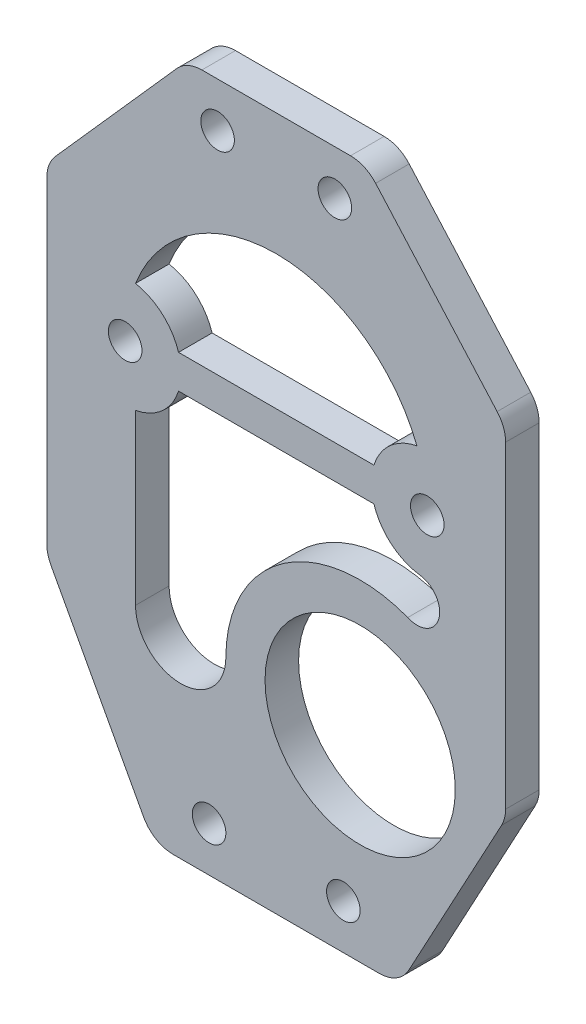
from build123d import *

# Parameters (mm, degrees)
SKETCH2_R           = 1.5
SKETCH2_R_2         = 8.5
BOSS_EXTRUDE2_DEPTH = 3
FILLET1_R           = 3


with BuildPart() as part:
    # Sketch2 → Boss-Extrude2 (new body)
    with BuildSketch(Plane.XY):
        Polygon((17.549495066, -24.63349929), (-4.450504934, -24.63349929), (-13.950504934, -7.033783383), (-13.950504934, 23.266216617), (-1.440329536, 37.36650071), (14.539319668, 37.36650071), (27.049495066, 23.266216617), (27.049495066, -7.033783383), align=None)
        with Locations((1.309670464, 33.36650071)):
            Circle(SKETCH2_R, mode=Mode.SUBTRACT)
        with Locations((-6.950504934, 12.966216617)):
            Circle(SKETCH2_R, mode=Mode.SUBTRACT)
        with Locations((0.549495066, -20.63349929)):
            Circle(SKETCH2_R, mode=Mode.SUBTRACT)
        with Locations(Location((12.549495066, -20.63349929, 0), (0, 0, 180))):
            Circle(SKETCH2_R, mode=Mode.SUBTRACT)
        with Locations(Location((20.049495066, 12.966216617, 0), (0, 0, 180))):
            Circle(SKETCH2_R, mode=Mode.SUBTRACT)
        with Locations(Location((11.789319668, 33.36650071, 0), (0, 0, 180))):
            Circle(SKETCH2_R, mode=Mode.SUBTRACT)
        with Locations((14.049495066, -7.033783383)):
            Circle(SKETCH2_R_2, mode=Mode.SUBTRACT)
        with BuildLine():
            Line((-6.024579008, 8.052698409), (-6.024579008, -7.033783383))
            ThreePointArc((-6.024579008, -7.033783383), (-1.987541971, -11.07082042), (2.049495066, -7.033783383))
            ThreePointArc((2.049495066, -7.033783383), (7.232677945, 2.841995287), (18.304662454, 4.186446138))
            ThreePointArc((18.304662454, 4.186446138), (21.07880608, 5.456718839), (19.40520679, 8.007901115))
            ThreePointArc((19.40520679, 8.007901115), (16.837362911, 9.134479803), (15.279799059, 11.466216617))
            Line((15.279799059, 11.466216617), (-2.180808927, 11.466216617))
            ThreePointArc((-2.180808927, 11.466216617), (-3.63040645, 9.227641212), (-6.024579008, 8.052698409))
        make_face(mode=Mode.SUBTRACT)
        with BuildLine():
            Line((-2.180808927, 14.466216617), (15.279799059, 14.466216617))
            ThreePointArc((15.279799059, 14.466216617), (16.729396583, 16.704792022), (19.12356914, 17.879734825))
            ThreePointArc((19.12356914, 17.879734825), (6.549495066, 26.466216617), (-6.024579008, 17.879734825))
            ThreePointArc((-6.024579008, 17.879734825), (-3.63040645, 16.704792022), (-2.180808927, 14.466216617))
        make_face(mode=Mode.SUBTRACT)
    extrude(amount=BOSS_EXTRUDE2_DEPTH)

    # Fillet1
    fillet1_edges = [part.edges().sort_by_distance(p)[0] for p in [
        (-13.950504934, -7.033783383, 1.5),
        (-13.950504934, 23.266216617, 1.5),
        (-1.440329536, 37.36650071, 1.5),
        (14.539319668, 37.36650071, 1.5),
        (27.049495066, 23.266216617, 1.5),
        (27.049495066, -7.033783383, 1.5),
        (17.549495066, -24.63349929, 1.5),
        (-4.450504934, -24.63349929, 1.5),
    ]]
    fillet(fillet1_edges, radius=FILLET1_R)


solid = part.part
